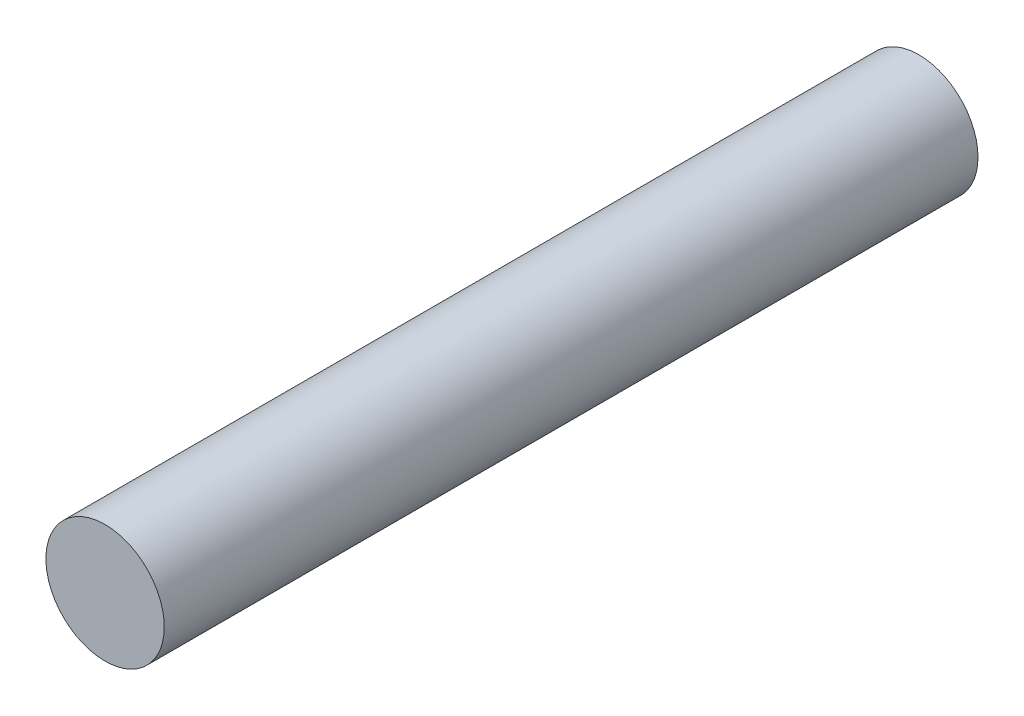
from build123d import *

# Parameters (mm, degrees)
SKETCH1_R           = 4
BOSS_EXTRUDE1_DEPTH = 55


with BuildPart() as part:
    # Sketch1 → Boss-Extrude1 (new body)
    with BuildSketch(Plane.XY):
        Circle(SKETCH1_R)
    extrude(amount=BOSS_EXTRUDE1_DEPTH)


solid = part.part
